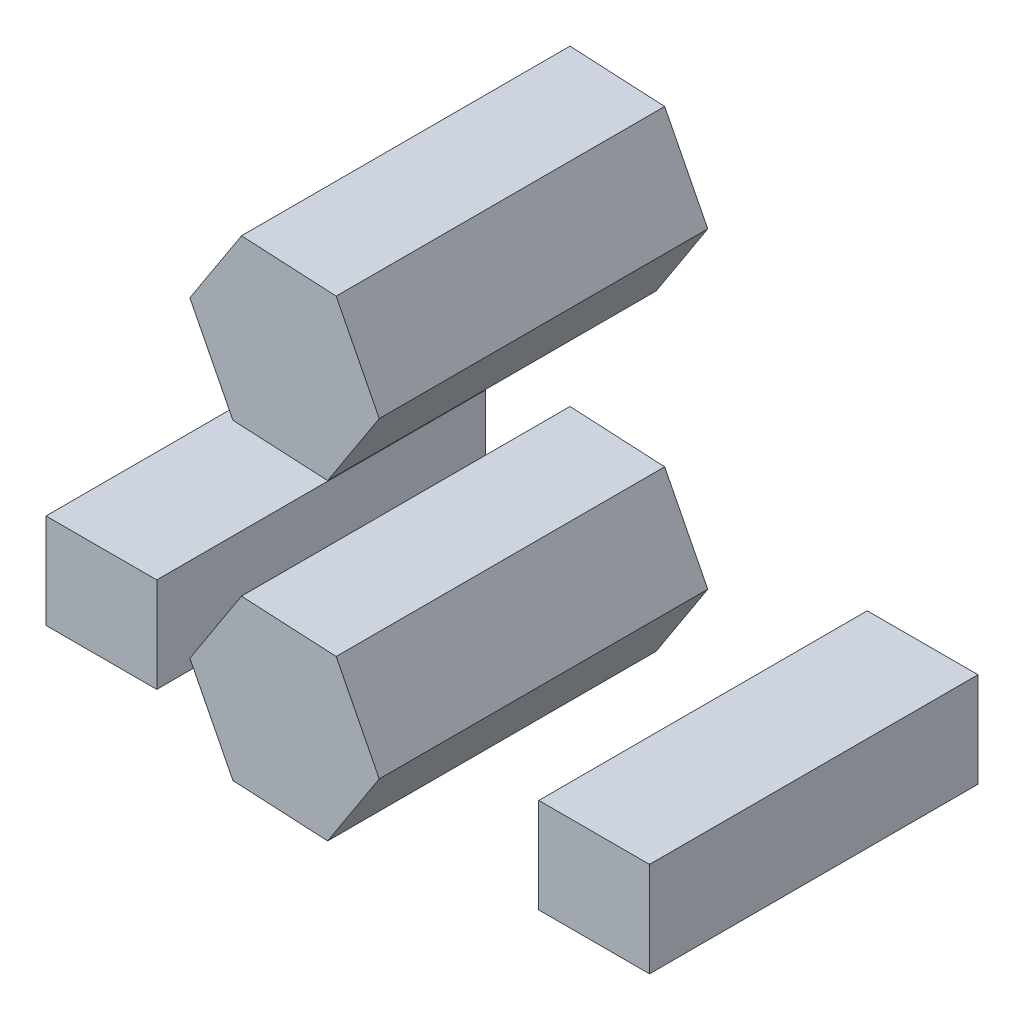
from build123d import *

# Parameters (mm, degrees)
BOSS_EXTRUDE1_DEPTH = 200
SKETCH2_W           = 67.437110829
SKETCH2_H           = 57.74
BOSS_EXTRUDE2_DEPTH = 200


with BuildPart() as part:
    # Sketch1 → Boss-Extrude1 (new body)
    with BuildSketch(Plane.XY):
        Polygon((57.656877736, -3.002962382), (31.429080577, 48.430839631), (-26.227797159, 51.433802013), (-57.656877736, 3.002962382), (-31.429080577, -48.430839631), (26.227797159, -51.433802013), align=None)
    extrude(amount=BOSS_EXTRUDE1_DEPTH)


with BuildPart() as body_2:
    # Sketch2 → Boss-Extrude2 (new body)
    with BuildSketch(Plane.XY):
        with Locations((-111.530606371, 5.320143602)):
            Rectangle(SKETCH2_W, SKETCH2_H)
    extrude(amount=BOSS_EXTRUDE2_DEPTH)


with BuildPart() as body_3:
    # Body-Move/Copy1: copy of body 2
    add(body_2.part.moved(Location((300, 0, 0))))


with BuildPart() as body_4:
    # Body-Move/Copy2: copy of part
    add(part.part.moved(Location((0, 190, 0))))


solid = Compound([part.part, body_2.part, body_3.part, body_4.part])
